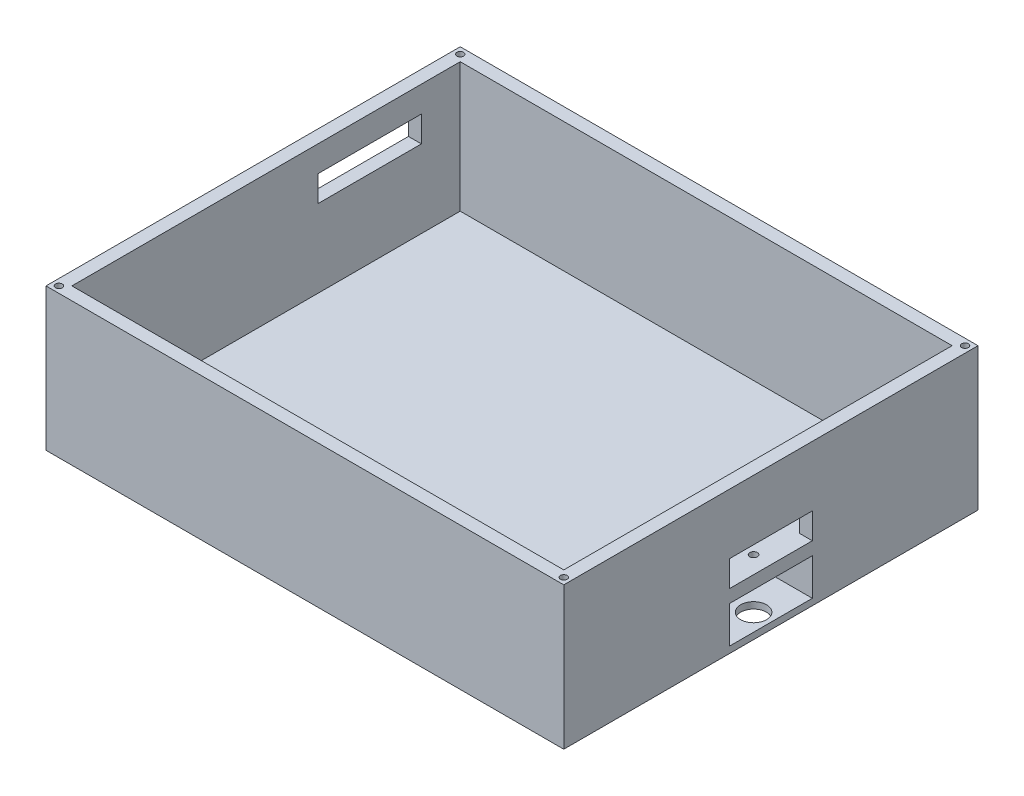
from build123d import *

# Parameters (mm, degrees)
SKETCH1_W                                  = 254
SKETCH1_H                                  = 203.2
BOSS_EXTRUDE1_DEPTH                        = 6.35
SKETCH2_W                                  = 6.35
SKETCH2_H                                  = 190.5
BOSS_EXTRUDE2_DEPTH                        = 63.5
SKETCH3_W                                  = 6.35
SKETCH3_H                                  = 40.64
CUT_EXTRUDE1_DEPTH                         = 63.5
SKETCH4_W                                  = 50.8
SKETCH4_H                                  = 40.64
CUT_EXTRUDE2_DEPTH                         = 3.175
SKETCH5_W                                  = 31.75
SKETCH5_H                                  = 6.35
BOSS_EXTRUDE3_DEPTH                        = 14.912951806
SKETCH6_W                                  = 38.1
SKETCH6_H                                  = 26.67
BOSS_EXTRUDE4_DEPTH                        = 6.35
CUT_EXTRUDE3_REACH                         = 170.034
SKETCH7_R                                  = 1.85
SKETCH8_W                                  = 6.35
SKETCH8_H                                  = 50.8
CUT_EXTRUDE4_DEPTH                         = 25.4
CUT_EXTRUDE5_REACH                         = 179.004
SKETCH9_R                                  = 6.35
SKETCH10_W                                 = 40.64
SKETCH10_H                                 = 29.537048194
BOSS_EXTRUDE5_DEPTH                        = 6.35
SKETCH11_W                                 = 50.8
SKETCH11_H                                 = 12.7
BOSS_EXTRUDE6_DEPTH                        = 6.35
SKETCH12_R                                 = 1.65
CUT_EXTRUDE6_DEPTH                         = 12
MIRROR2_AT_THE_SECOND_PLANE_COPY_1_SKETC_R = 1.65
MIRROR2_AT_THE_SECOND_PLANE_COPY_1_DEPTH   = 12


with BuildPart() as part:
    # Sketch1 → Boss-Extrude1 (new body)
    with BuildSketch(Plane(origin=(0, 0, 0), x_dir=(1, 0, 0), z_dir=(0, 1, 0))):
        Rectangle(SKETCH1_W, SKETCH1_H)
    extrude(amount=BOSS_EXTRUDE1_DEPTH)

    # Sketch2 → Boss-Extrude2 (add)
    with BuildSketch(Plane(origin=(0, 6.35, 0), x_dir=(1, 0, 0), z_dir=(0, 1, 0))):
        with Locations((-123.825, 0)):
            Rectangle(SKETCH2_W, SKETCH2_H)
        Polygon((127, 101.6), (-127, 101.6), (-127, 95.25), (-120.65, 95.25), (120.65, 95.25), (127, 95.25), align=None)
        with Locations((123.825, 0)):
            Rectangle(SKETCH2_W, SKETCH2_H)
        Polygon((-120.65, -95.25), (-127, -95.25), (-127, -101.6), (127, -101.6), (127, -95.25), (120.65, -95.25), align=None)
    extrude(amount=BOSS_EXTRUDE2_DEPTH)

    # Sketch3 → Cut-Extrude1 (cut)
    with BuildSketch(Plane(origin=(0, 69.85, 0), x_dir=(1, 0, 0), z_dir=(0, 1, 0))):
        with Locations((123.825, 0)):
            Rectangle(SKETCH3_W, SKETCH3_H)
    extrude(amount=-CUT_EXTRUDE1_DEPTH, mode=Mode.SUBTRACT)

    # Sketch4 → Cut-Extrude2 (cut)
    with BuildSketch(Plane(origin=(0, 6.35, 0), x_dir=(1, 0, 0), z_dir=(0, 1, 0))):
        with Locations((101.6, 0)):
            Rectangle(SKETCH4_W, SKETCH4_H)
    extrude(amount=-CUT_EXTRUDE2_DEPTH, mode=Mode.SUBTRACT)

    # Sketch5 → Boss-Extrude3 (add)
    with BuildSketch(Plane(origin=(0, 6.35, 0), x_dir=(1, 0, 0), z_dir=(0, 1, 0))):
        with Locations((104.775, 23.495)):
            Rectangle(SKETCH5_W, SKETCH5_H)
    boss_extrude3 = extrude(amount=BOSS_EXTRUDE3_DEPTH)

    # Sketch6 → Boss-Extrude4 (add)
    with BuildSketch(Plane(origin=(0, 21.262951806, 0), x_dir=(1, 0, 0), z_dir=(0, 1, 0))):
        with Locations((107.95, 13.335)):
            Rectangle(SKETCH6_W, SKETCH6_H)
    boss_extrude4 = extrude(amount=BOSS_EXTRUDE4_DEPTH)

    # Mirror1: Boss-Extrude3, Boss-Extrude4 across plane
    add(boss_extrude3.mirror(Plane.XY))
    add(boss_extrude4.mirror(Plane.XY))

    # Sketch7 → Cut-Extrude3 (cut, up to next)
    with BuildSketch(Plane(origin=(0, 27.612951806, 0), x_dir=(1, 0, 0), z_dir=(0, 1, 0)), mode=Mode.PRIVATE) as cut_extrude3_sk1:
        with Locations(Location((99.4, 0, 0), (0, 0, 270))):
            Circle(SKETCH7_R)
    cut_extrude3_tool1 = extrude(cut_extrude3_sk1.sketch, amount=-CUT_EXTRUDE3_REACH, mode=Mode.PRIVATE) & part.part
    # Sketch7 → Cut-Extrude3 (cut, up to next)
    with BuildSketch(Plane(origin=(0, 27.612951806, 0), x_dir=(1, 0, 0), z_dir=(0, 1, 0)), mode=Mode.PRIVATE) as cut_extrude3_sk2:
        with Locations(Location((118.5, 0, 0), (0, 0, 270))):
            Circle(SKETCH7_R)
    cut_extrude3_tool2 = extrude(cut_extrude3_sk2.sketch, amount=-CUT_EXTRUDE3_REACH, mode=Mode.PRIVATE) & part.part
    add(cut_extrude3_tool1.solids().sort_by_distance((99.4, 27.612952, 0))[0], mode=Mode.SUBTRACT)
    add(cut_extrude3_tool2.solids().sort_by_distance((118.5, 27.612952, 0))[0], mode=Mode.SUBTRACT)

    # Sketch8 → Cut-Extrude4 (cut)
    with BuildSketch(Plane(origin=(0, 69.85, 0), x_dir=(1, 0, 0), z_dir=(0, 1, 0))):
        with Locations((-123.825, 50.8)):
            Rectangle(SKETCH8_W, SKETCH8_H)
    extrude(amount=-CUT_EXTRUDE4_DEPTH, mode=Mode.SUBTRACT)

    # Sketch9 → Cut-Extrude5 (cut, up to next)
    with BuildSketch(Plane.XZ, mode=Mode.PRIVATE) as cut_extrude5_sk1:
        with Locations(Location((99.4, 0, 0), (0, 0, 270))):
            Circle(SKETCH9_R)
    cut_extrude5_tool1 = extrude(cut_extrude5_sk1.sketch, amount=-CUT_EXTRUDE5_REACH, mode=Mode.PRIVATE) & part.part
    # Sketch9 → Cut-Extrude5 (cut, up to next)
    with BuildSketch(Plane.XZ, mode=Mode.PRIVATE) as cut_extrude5_sk2:
        with Locations(Location((118.5, 0, 0), (0, 0, 270))):
            Circle(SKETCH9_R)
    cut_extrude5_tool2 = extrude(cut_extrude5_sk2.sketch, amount=-CUT_EXTRUDE5_REACH, mode=Mode.PRIVATE) & part.part
    add(cut_extrude5_tool1.solids().sort_by_distance((99.4, 0, 0))[0], mode=Mode.SUBTRACT)
    add(cut_extrude5_tool2.solids().sort_by_distance((118.5, 0, 0))[0], mode=Mode.SUBTRACT)

    # Sketch10 → Boss-Extrude5 (add)
    with BuildSketch(Plane(origin=(127, 0, 0), x_dir=(0, 0, -1), z_dir=(1, 0, 0))):
        with Locations((0, 55.081475903)):
            Rectangle(SKETCH10_W, SKETCH10_H)
    extrude(amount=-BOSS_EXTRUDE5_DEPTH)

    # Sketch11 → Boss-Extrude6 (add)
    with BuildSketch(Plane.ZY.offset(127)):
        with Locations((-50.8, 63.5)):
            Rectangle(SKETCH11_W, SKETCH11_H)
    extrude(amount=-BOSS_EXTRUDE6_DEPTH)

    # Sketch12 → Cut-Extrude6 (cut)
    with BuildSketch(Plane(origin=(0, 69.85, 0), x_dir=(1, 0, 0), z_dir=(0, 1, 0))):
        with Locations(Location((-123.825, 98.425, 0), (0, 0, 270))):
            Circle(SKETCH12_R)
    cut_extrude6 = extrude(amount=-CUT_EXTRUDE6_DEPTH, mode=Mode.SUBTRACT)

    # Mirror2: Cut-Extrude6 across plane
    add(cut_extrude6.mirror(Plane.XY), mode=Mode.SUBTRACT)

    # Mirror2 at the second plane: Cut-Extrude6 across plane
    add(cut_extrude6.mirror(Plane(origin=(0, 0, 0), x_dir=(0, 0, 1), z_dir=(1, 0, 0))), mode=Mode.SUBTRACT)

    # Mirror2 at the second plane copy 1 sketc → Mirror2 at the second plane copy 1 (cut)
    with BuildSketch(Plane(origin=(0, 69.85, 0), x_dir=(-1, 0, 0), z_dir=(0, 1, 0))):
        with Locations(Location((-123.825, 98.425, 0), (0, 0, 270))):
            Circle(MIRROR2_AT_THE_SECOND_PLANE_COPY_1_SKETC_R)
    extrude(amount=-MIRROR2_AT_THE_SECOND_PLANE_COPY_1_DEPTH, mode=Mode.SUBTRACT)


solid = part.part
